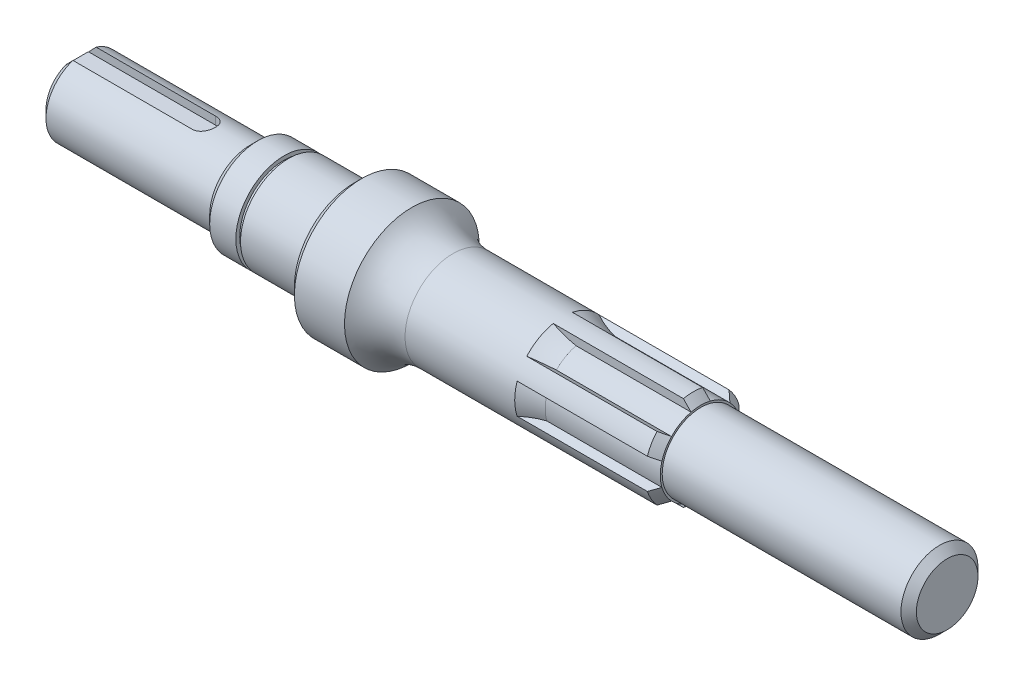
from build123d import *

# Parameters (mm, degrees)
CUT_EXTRUDE_START   = 10
CUT_EXTRUDE_1_DEPTH = 2.5
SKETCH_4_W          = 1.2
SKETCH_4_H          = 1
EXTRUDE_START       = -99.8
EXTRUDE_11_DEPTH    = 35.8
CHAMFER_1_SIZE      = 2


with BuildPart() as part:
    # 草图1 → 旋转1 (revolve)
    with BuildSketch(Plane.XY, mode=Mode.PRIVATE) as revolve_1_sk:
        with BuildLine():
            Line((0, 10), (0, 0))
            Line((0, 0), (226, 0))
            Line((226, 0), (226, 10))
            Line((226, 10), (162, 10))
            Line((162, 10), (162, 12.5))
            Line((162, 12.5), (97.723805295, 12.5))
            ThreePointArc((97.723805295, 12.5), (91.807725512, 13.81142246), (87, 17.5))
            Line((87, 17.5), (72, 17.5))
            Line((72, 17.5), (72, 12.5))
            Line((72, 12.5), (45, 12.5))
            Line((45, 12.5), (45, 10))
            Line((45, 10), (0, 10))
        make_face()
    revolve(revolve_1_sk.sketch.rotate(Axis((0, 0, 0), (1, 0, 0)), 90), axis=Axis((0, 0, 0), (1, 0, 0)))

    # 草图3 → 切除-拉伸1 (cut)
    with BuildSketch(Plane(origin=(0, 0, 0), x_dir=(1, 0, 0), z_dir=(0, 1, 0)).offset(CUT_EXTRUDE_START)):
        with BuildLine():
            Line((-33, 3), (33, 3))
            ThreePointArc((33, 3), (36, 0), (33, -3))
            Line((33, -3), (-33, -3))
            ThreePointArc((-33, -3), (-36, 0), (-33, 3))
        make_face()
    extrude(amount=-CUT_EXTRUDE_1_DEPTH, mode=Mode.SUBTRACT)

    # 草图4 → 切除-旋转1 (revolve, cut)
    with BuildSketch(Plane.XY, mode=Mode.PRIVATE) as cut_revolve_1_sk:
        with Locations((54.4, 12)):
            Rectangle(SKETCH_4_W, SKETCH_4_H)
        with Locations((54.4, -12)):
            Rectangle(SKETCH_4_W, SKETCH_4_H)
    revolve(cut_revolve_1_sk.sketch.rotate(Axis((0, 0, 0), (1, 0, 0)), 90), axis=Axis((0, 0, 0), (1, 0, 0)), mode=Mode.SUBTRACT)

    # 草图5 → 切除-旋转2 (revolve, cut)
    with BuildSketch(Plane.XY, mode=Mode.PRIVATE) as cut_revolve_2_sk:
        with BuildLine():
            Line((162, 12.5), (126.2, 12.5))
            ThreePointArc((126.2, 12.5), (131.507077415, 10.633014138), (137.097247359, 10))
            Line((137.097247359, 10), (162, 10))
            Line((162, 10), (162, 12.5))
        make_face()
    revolve(cut_revolve_2_sk.sketch.rotate(Axis((0, 0, 0), (1, 0, 0)), 90), axis=Axis((0, 0, 0), (1, 0, 0)), mode=Mode.SUBTRACT)

    # 草图8 → 凸台-拉伸11 (add)
    with BuildSketch(Plane(origin=(226, 0, 0), x_dir=(0, 0, -1), z_dir=(1, 0, 0)).offset(EXTRUDE_START)):
        with BuildLine():
            Line((9.356601718, 8.288787866), (7.581760866, 7.264083023))
            ThreePointArc((7.581760866, 7.264083023), (5.25, 9.09326674), (2.5, 10.198039027))
            Line((2.5, 10.198039027), (2.5, 12.247448714))
            ThreePointArc((2.5, 12.247448714), (0, 12.5), (-2.5, 12.247448714))
            Line((-2.5, 12.247448714), (-2.5, 10.198039027))
            ThreePointArc((-2.5, 10.198039027), (-5.25, 9.09326674), (-7.581760866, 7.264083023))
            Line((-7.581760866, 7.264083023), (-9.356601718, 8.288787866))
            ThreePointArc((-9.356601718, 8.288787866), (-10.825317547, 6.25), (-11.856601718, 3.958660847))
            Line((-11.856601718, 3.958660847), (-10.081760866, 2.933956004))
            ThreePointArc((-10.081760866, 2.933956004), (-10.5, 0), (-10.081760866, -2.933956004))
            Line((-10.081760866, -2.933956004), (-11.856601718, -3.958660847))
            ThreePointArc((-11.856601718, -3.958660847), (-10.825317547, -6.25), (-9.356601718, -8.288787866))
            Line((-9.356601718, -8.288787866), (-7.581760866, -7.264083023))
            ThreePointArc((-7.581760866, -7.264083023), (-5.25, -9.09326674), (-2.5, -10.198039027))
            Line((-2.5, -10.198039027), (-2.5, -12.247448714))
            ThreePointArc((-2.5, -12.247448714), (0, -12.5), (2.5, -12.247448714))
            Line((2.5, -12.247448714), (2.5, -10.198039027))
            ThreePointArc((2.5, -10.198039027), (5.25, -9.09326674), (7.581760866, -7.264083023))
            Line((7.581760866, -7.264083023), (9.356601718, -8.288787866))
            ThreePointArc((9.356601718, -8.288787866), (10.825317547, -6.25), (11.856601718, -3.958660847))
            Line((11.856601718, -3.958660847), (10.081760866, -2.933956004))
            ThreePointArc((10.081760866, -2.933956004), (10.5, 0), (10.081760866, 2.933956004))
            Line((10.081760866, 2.933956004), (11.856601718, 3.958660847))
            ThreePointArc((11.856601718, 3.958660847), (10.825317547, 6.25), (9.356601718, 8.288787866))
        make_face()
    extrude(amount=EXTRUDE_11_DEPTH)

    # 倒角1
    chamfer_1_edges = [part.edges().sort_by_distance(p)[0] for p in [
        (226, 0, -10),
        (162, 6.25, -10.825317547),
        (162, -6.25, -10.825317547),
        (162, -12.5, 0),
        (162, -6.25, 10.825317547),
        (162, 6.25, 10.825317547),
        (162, 12.5, 0),
        (72, 0, -17.5),
        (45, 0, -12.5),
        (0, -8.062257748, -5.916079783),
    ]]
    chamfer(chamfer_1_edges, length=CHAMFER_1_SIZE)


solid = part.part
